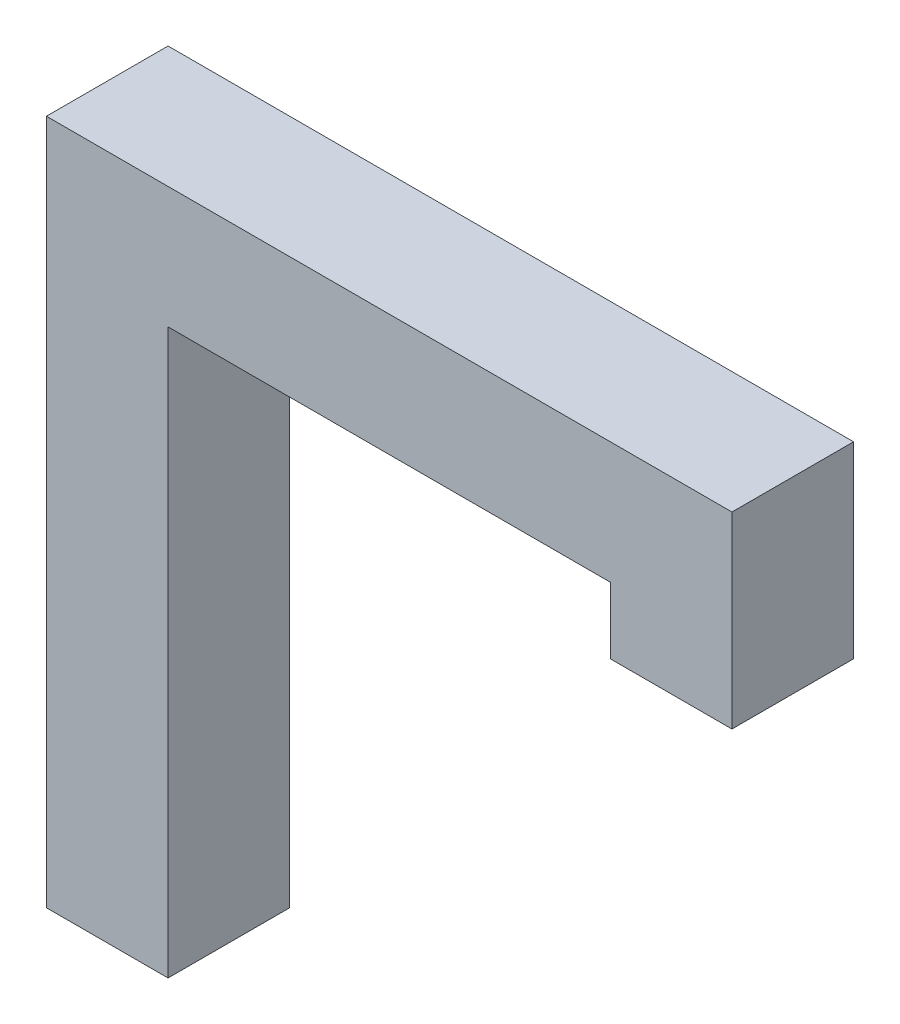
from build123d import *

# Parameters (mm, degrees)
EXTRUDE_1_DEPTH = 5.5


with BuildPart() as part:
    # ｽｹｯﾁ1 → ﾎﾞｽ - 押し出し1 (new body)
    with BuildSketch(Plane.XY):
        Polygon((0, 0), (-5.5, 0), (-5.5, 31), (25.5, 31), (25.5, 22.5), (20, 22.5), (20, 25.5), (0, 25.5), align=None)
    extrude(amount=EXTRUDE_1_DEPTH)


solid = part.part
